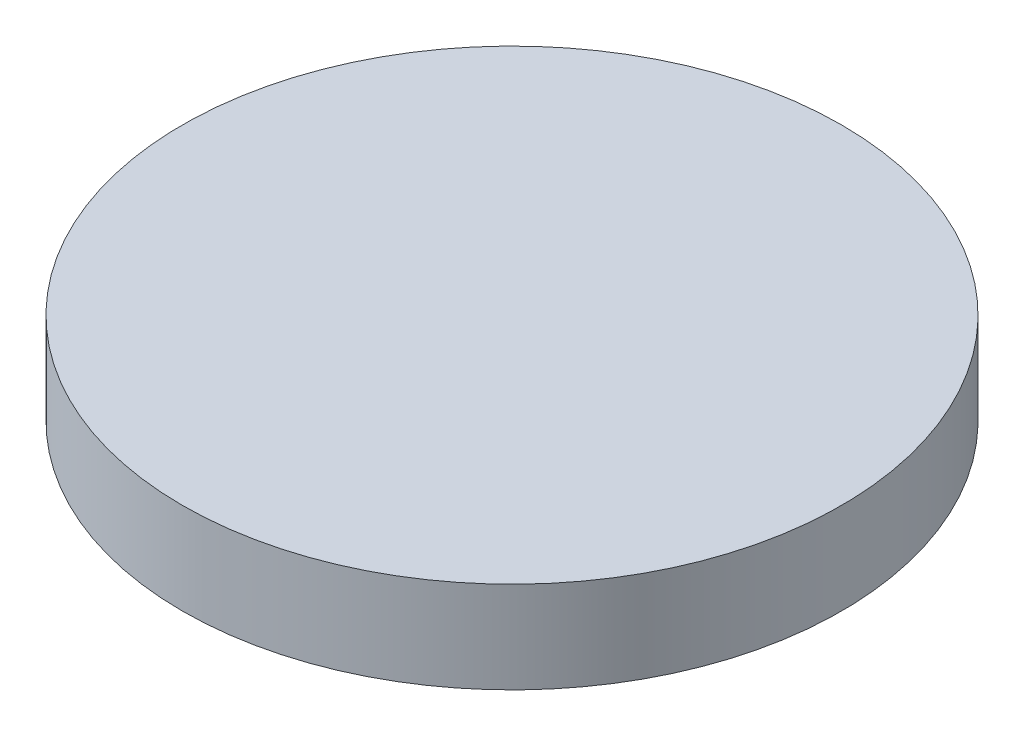
from build123d import *

# Parameters (mm, degrees)
SKETCH1_R           = 11.43
BOSS_EXTRUDE1_DEPTH = 3.175


with BuildPart() as part:
    # Sketch1 → Boss-Extrude1 (new body)
    with BuildSketch(Plane(origin=(0, 0, 0), x_dir=(1, 0, 0), z_dir=(0, 1, 0))):
        with Locations(Location((4.999655882, -4.961936119, 0), (0, 0, 270))):
            Circle(SKETCH1_R)
    extrude(amount=BOSS_EXTRUDE1_DEPTH)


solid = part.part
